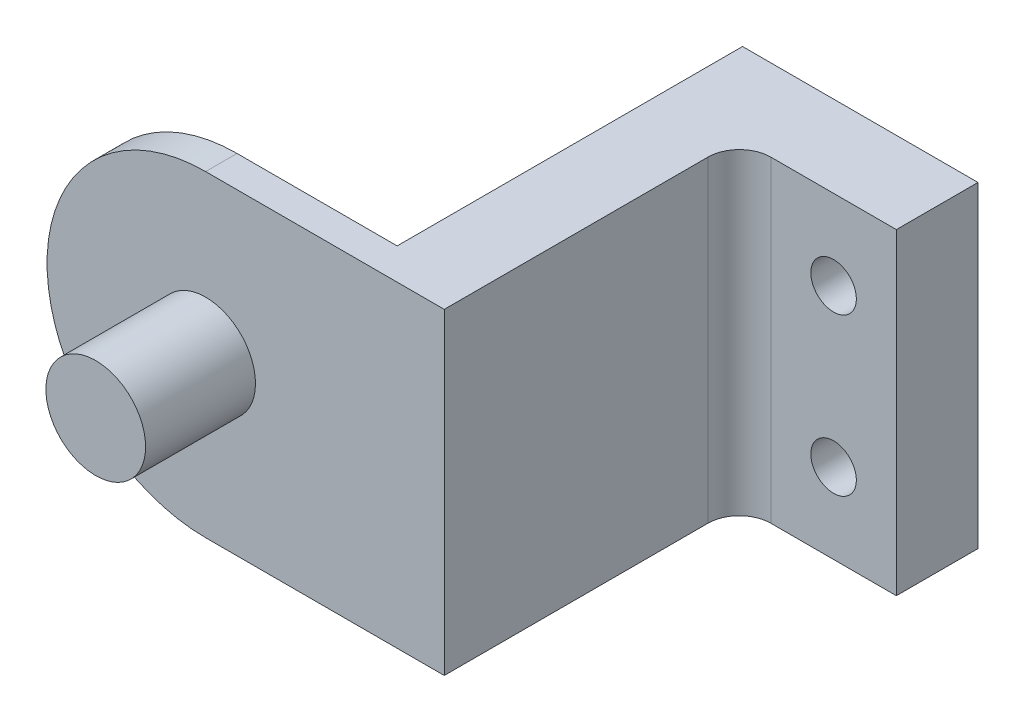
from build123d import *

# Parameters (mm, degrees)
ESQUISSE1_W         = 5
ESQUISSE1_H         = 20.2
BOSS_EXTRU_1_DEPTH  = 22
BOSS_EXTRU_2_DEPTH  = 2
ESQUISSE3_R         = 3.175
BOSS_EXTRU_3_DEPTH  = 7
SKETCH1_W           = 5.2
SKETCH1_H           = 20.2
BOSS_EXTRUDE1_DEPTH = 10
SKETCH2_R           = 1.45
CUT_EXTRUDE1_DEPTH  = 40.785047442
FILLET1_R           = 2


with BuildPart() as part:
    # Esquisse1 → Boss.-Extru.1 (new body)
    with BuildSketch(Plane.XY):
        Rectangle(ESQUISSE1_W, ESQUISSE1_H)
    extrude(amount=BOSS_EXTRU_1_DEPTH)

    # Esquisse2 → Boss.-Extru.2 (add)
    with BuildSketch(Plane.XY.offset(22)):
        with BuildLine():
            Line((2.5, 10.1), (-12.7, 10.1))
            ThreePointArc((-12.7, 10.1), (-22.8, 0), (-12.7, -10.1))
            Line((-12.7, -10.1), (2.5, -10.1))
            Line((2.5, -10.1), (2.5, 10.1))
        make_face()
    extrude(amount=BOSS_EXTRU_2_DEPTH)

    # Esquisse3 → Boss.-Extru.3 (add)
    with BuildSketch(Plane.XY.offset(24)):
        with Locations((-12.7, 0)):
            Circle(ESQUISSE3_R)
    extrude(amount=BOSS_EXTRU_3_DEPTH)

    # Sketch1 → Boss-Extrude1 (add)
    with BuildSketch(Plane(origin=(2.5, 0, 0), x_dir=(0, 0, -1), z_dir=(1, 0, 0))):
        with Locations((-2.6, 0)):
            Rectangle(SKETCH1_W, SKETCH1_H)
    extrude(amount=BOSS_EXTRUDE1_DEPTH)

    # Sketch2 → Cut-Extrude1 (cut, through all)
    with BuildSketch(Plane(origin=(0, 0, 0), x_dir=(-1, 0, 0), z_dir=(0, 0, -1))):
        with Locations((-8.5, -5)):
            Circle(SKETCH2_R)
        with Locations((-8.5, 5)):
            Circle(SKETCH2_R)
    extrude(amount=-CUT_EXTRUDE1_DEPTH, mode=Mode.SUBTRACT)

    # Fillet1
    fillet1_edges = [part.edges().sort_by_distance(p)[0] for p in [
        (2.5, 0, 5.2),
    ]]
    fillet(fillet1_edges, radius=FILLET1_R)


solid = part.part
